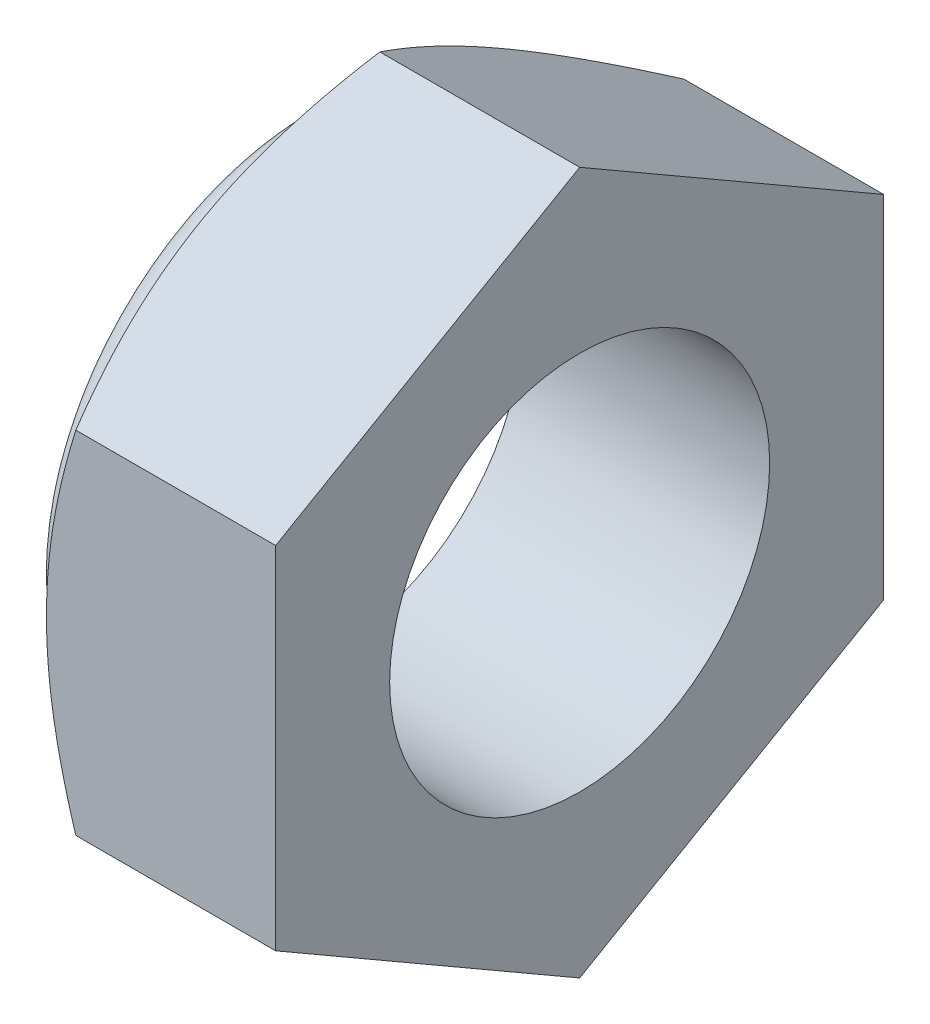
from build123d import *

# Parameters (mm, degrees)
SKETCH1_R           = 10
BOSS_EXTRUDE1_DEPTH = 13


with BuildPart() as part:
    # Sketch1 → Boss-Extrude1 (new body)
    with BuildSketch(Plane(origin=(0, 0, 0), x_dir=(0, 0, -1), z_dir=(1, 0, 0))):
        Polygon((-16, 9.237604307), (-16, -9.237604307), (0, -18.475208614), (16, -9.237604307), (16, 9.237604307), (0, 18.475208614), align=None)
        with Locations(Location((0, 0, 0), (0, 0, 180))):
            Circle(SKETCH1_R, mode=Mode.SUBTRACT)
    extrude(amount=BOSS_EXTRUDE1_DEPTH)

    # Sketch2 → Cut-Revolve1 (revolve, cut)
    with BuildSketch(Plane(origin=(0, 0, 0), x_dir=(1, 0, 0), z_dir=(0, 1, 0)), mode=Mode.PRIVATE) as cut_revolve1_sk:
        Polygon((0, 14.5), (3.137550133, 19.521191174), (-1.152758785, 19.521191174), (-1.152758785, 14.5), align=None)
    revolve(cut_revolve1_sk.sketch.rotate(Axis((0, 0, 0), (1, 0, 0)), 29.999999997), axis=Axis((0, 0, 0), (1, 0, 0)), mode=Mode.SUBTRACT)

    # Sketch4 → Revolve1 (revolve)
    with BuildSketch(Plane(origin=(0, 0, 0), x_dir=(1, 0, 0), z_dir=(0, 1, 0)), mode=Mode.PRIVATE) as revolve1_sk:
        with BuildLine():
            Line((0, 11.75), (0, 14.5))
            ThreePointArc((0, 14.5), (-1.375, 13.125), (0, 11.75))
        make_face()
    revolve(revolve1_sk.sketch.rotate(Axis((0, 0, 0), (1, 0, 0)), 180), axis=Axis((0, 0, 0), (1, 0, 0)))


solid = part.part
